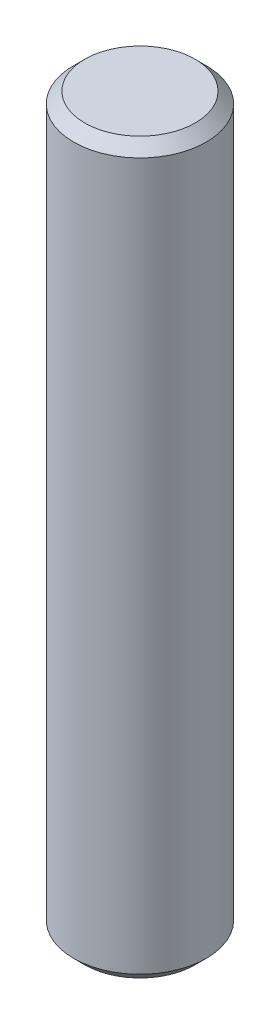
from build123d import *

# Parameters (mm, degrees)
SZKIC1_R                    = 3
DODANIE_WYCI_GNI_CIE1_DEPTH = 33
SFAZOWANIE1_SIZE            = 0.5


with BuildPart() as part:
    # Szkic1 → Dodanie-wyciągnięcie1 (new body)
    with BuildSketch(Plane(origin=(0, 0, 0), x_dir=(1, 0, 0), z_dir=(0, 1, 0))):
        with Locations(Location((0, 0, 0), (0, 0, 270))):
            Circle(SZKIC1_R)
    extrude(amount=DODANIE_WYCI_GNI_CIE1_DEPTH)

    # Sfazowanie1
    sfazowanie1_edges = [part.edges().sort_by_distance(p)[0] for p in [
        (0, 0, -3),
        (0, 33, -3),
    ]]
    chamfer(sfazowanie1_edges, length=SFAZOWANIE1_SIZE)


solid = part.part
